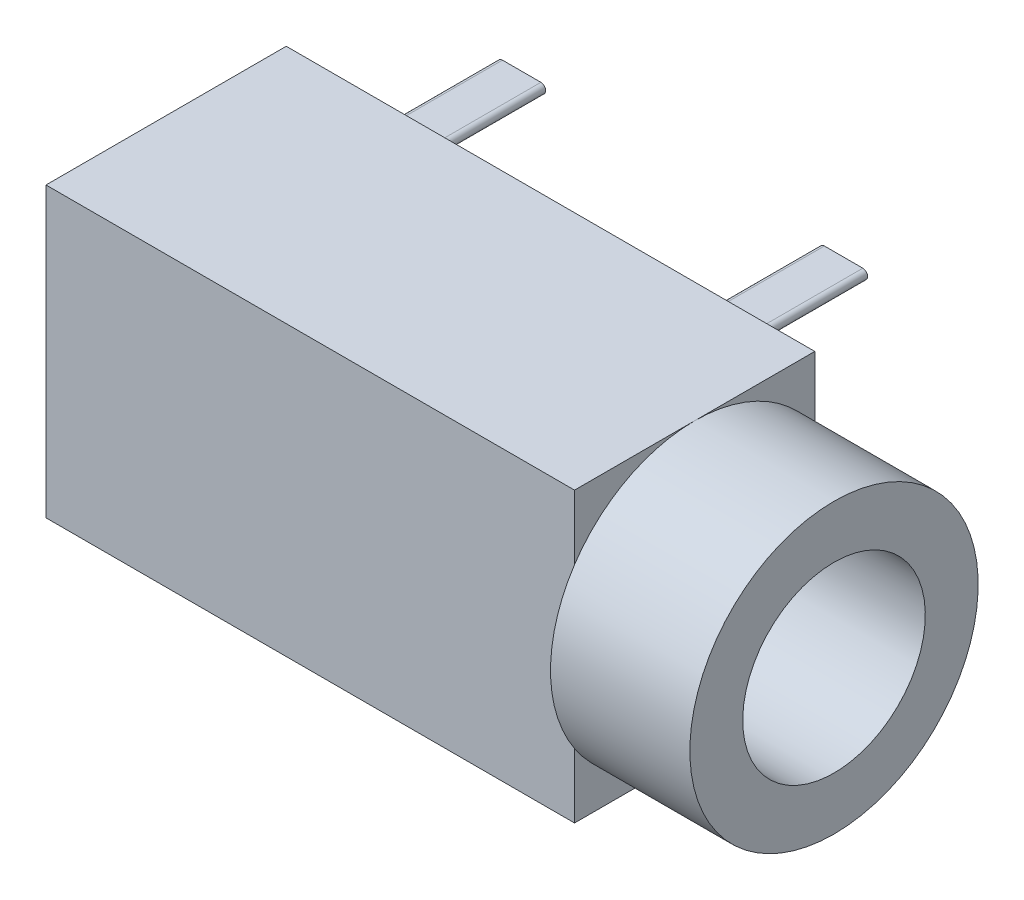
from build123d import *

# Parameters (mm, degrees)
SKETCH1_W           = 11
SKETCH1_H           = 6
BOSS_EXTRUDE1_DEPTH = 5
SKETCH2_R           = 3
SKETCH2_R_2         = 1.9
BOSS_EXTRUDE2_DEPTH = 2.9
BOSS_EXTRUDE3_DEPTH = 2.9


with BuildPart() as part:
    # Sketch1 → Boss-Extrude1 (new body)
    with BuildSketch(Plane.XY):
        Rectangle(SKETCH1_W, SKETCH1_H)
    extrude(amount=BOSS_EXTRUDE1_DEPTH)

    # Sketch2 → Boss-Extrude2 (add)
    with BuildSketch(Plane(origin=(5.5, 0, 0), x_dir=(0, 0, -1), z_dir=(1, 0, 0))):
        with Locations(Location((-2.5, 0, 0), (0, 0, 90))):
            Circle(SKETCH2_R)
        with Locations(Location((-2.5, 0, 0), (0, 0, 90))):
            Circle(SKETCH2_R_2, mode=Mode.SUBTRACT)
    extrude(amount=BOSS_EXTRUDE2_DEPTH)

    # Sketch3 → Boss-Extrude3 (add)
    with BuildSketch(Plane(origin=(0, 0, 0), x_dir=(-1, 0, 0), z_dir=(0, 0, -1))):
        with BuildLine():
            Line((-3.6, 2.1), (-2.8, 2.1))
            ThreePointArc((-2.8, 2.1), (-2.7, 2), (-2.8, 1.9))
            Line((-2.8, 1.9), (-3.6, 1.9))
            ThreePointArc((-3.6, 1.9), (-3.7, 2), (-3.6, 2.1))
        make_face()
        with BuildLine():
            Line((3.9, 1.9), (3.1, 1.9))
            ThreePointArc((3.1, 1.9), (3, 2), (3.1, 2.1))
            Line((3.1, 2.1), (3.9, 2.1))
            ThreePointArc((3.9, 2.1), (4, 2), (3.9, 1.9))
        make_face()
        with BuildLine():
            Line((-1.7, -1.9), (-0.9, -1.9))
            ThreePointArc((-0.9, -1.9), (-0.8, -2), (-0.9, -2.1))
            Line((-0.9, -2.1), (-1.7, -2.1))
            ThreePointArc((-1.7, -2.1), (-1.8, -2), (-1.7, -1.9))
        make_face()
    extrude(amount=BOSS_EXTRUDE3_DEPTH)


solid = part.part
